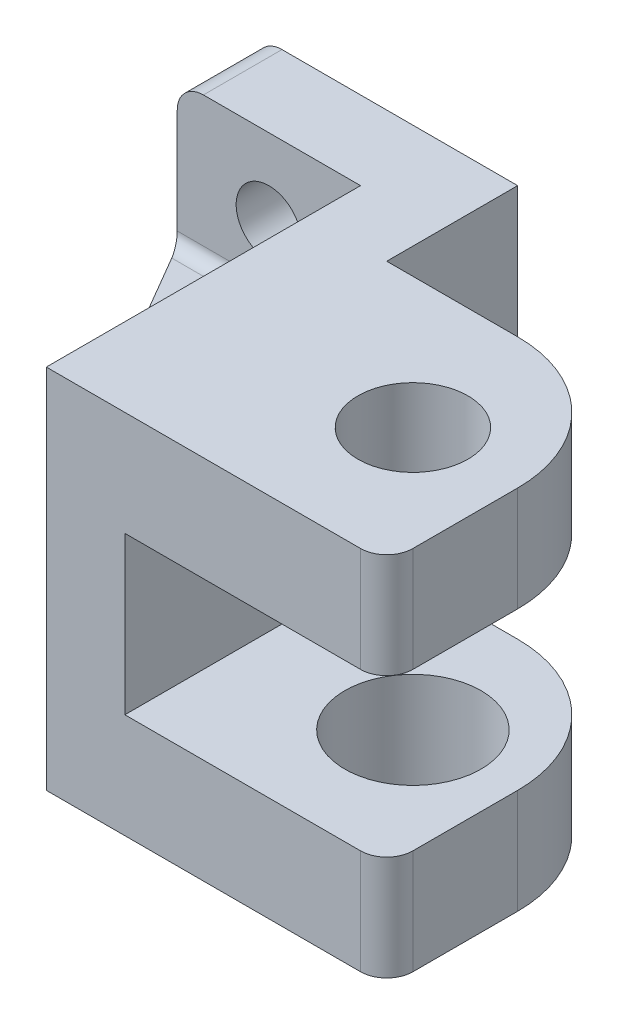
from build123d import *

# Parameters (mm, degrees)
SKETCH_1_W          = 10
SKETCH_1_H          = 14
EXTRUDE_1_DEPTH     = 3
SKETCH_2_W          = 3
SKETCH_2_H          = 14
EXTRUDE_2_DEPTH     = 12
RIB_1_REACH         = 19.292
SKETCH_3_WALL_W     = 50.475676922
SKETCH_3_WALL_H     = 3
HOLE_WIZARD_M3_2_D  = 2.5
SKETCH_7_W          = 10
SKETCH_7_H          = 4
EXTRUDE_3_DEPTH     = 10
FILLET_1_R          = 1
FILLET_2_R          = 0.5
FILLET_3_R          = 1
SKETCH_8_R          = 2.6
CUT_EXTRUDE_3_DEPTH = 4
HOLE_WIZARD_M5_1_D  = 4.2
FILLET_5_R          = 5


with BuildPart() as part:
    # 草图1 → 凸台-拉伸1 (new body)
    with BuildSketch(Plane.XY):
        Rectangle(SKETCH_1_W, SKETCH_1_H)
    extrude(amount=EXTRUDE_1_DEPTH)

    # 草图2 → 凸台-拉伸2 (add)
    with BuildSketch(Plane.XY.offset(3)):
        with Locations((3.5, 0)):
            Rectangle(SKETCH_2_W, SKETCH_2_H)
    extrude(amount=EXTRUDE_2_DEPTH)

    # 草图3 wall → 筋1 (add, up to next)
    with BuildSketch(Plane(origin=(-1.5, 0, 9), x_dir=(0.503871025524, 0, 0.863778900898), z_dir=(-0.863778900898, 0, 0.503871025524)), mode=Mode.PRIVATE) as rib_1_sk1:
        Rectangle(SKETCH_3_WALL_W, SKETCH_3_WALL_H)
    rib_1_tool1 = extrude(rib_1_sk1.sketch, amount=-RIB_1_REACH, mode=Mode.PRIVATE) - part.part
    add(rib_1_tool1.solids().sort_by_distance((-1.5, 0, 9))[0])

    # M3 螺纹孔2 (through all)
    with Locations(Plane(origin=(-1.5, 4, 3), x_dir=(1, 0, 0), z_dir=(0, 0, 1))):
        with Locations((0, 0), (0, -8)):
            Hole(HOLE_WIZARD_M3_2_D / 2)

    # 草图7 → 凸台-拉伸3 (add)
    with BuildSketch(Plane(origin=(5, 0, 0), x_dir=(0, 0, -1), z_dir=(1, 0, 0))):
        with Locations((-10, -5)):
            Rectangle(SKETCH_7_W, SKETCH_7_H)
        with Locations((-10, 5)):
            Rectangle(SKETCH_7_W, SKETCH_7_H)
    extrude(amount=EXTRUDE_3_DEPTH)

    # 圆角1
    fillet_1_edges = [part.edges().sort_by_distance(p)[0] for p in [
        (15, -5, 15),
        (15, 5, 15),
    ]]
    fillet(fillet_1_edges, radius=FILLET_1_R)

    # 圆角2
    fillet_2_edges = [part.edges().sort_by_distance(p)[0] for p in [
        (2, -1.5, 9),
        (-1.5, 1.5, 3),
        (-1.5, -1.5, 3),
        (2, 1.5, 9),
    ]]
    fillet(fillet_2_edges, radius=FILLET_2_R)

    # 圆角3
    fillet_3_edges = [part.edges().sort_by_distance(p)[0] for p in [
        (-5, -7, 1.5),
        (-5, 7, 1.5),
    ]]
    fillet(fillet_3_edges, radius=FILLET_3_R)

    # 草图8 → 切除-拉伸3 (cut)
    with BuildSketch(Plane.XZ.offset(7)):
        with Locations(Location((11, 10, 0), (0, 0, 270))):
            Circle(SKETCH_8_R)
    extrude(amount=-CUT_EXTRUDE_3_DEPTH, mode=Mode.SUBTRACT)

    # M5 螺纹孔1 (through all)
    with Locations(Plane(origin=(0, 7, 0), x_dir=(1, 0, 0), z_dir=(0, 1, 0))):
        with Locations((11, -10)):
            Hole(HOLE_WIZARD_M5_1_D / 2)

    # 圆角5
    fillet_5_edges = [part.edges().sort_by_distance(p)[0] for p in [
        (15, -5, 5),
        (15, 5, 5),
    ]]
    fillet(fillet_5_edges, radius=FILLET_5_R)


solid = part.part
